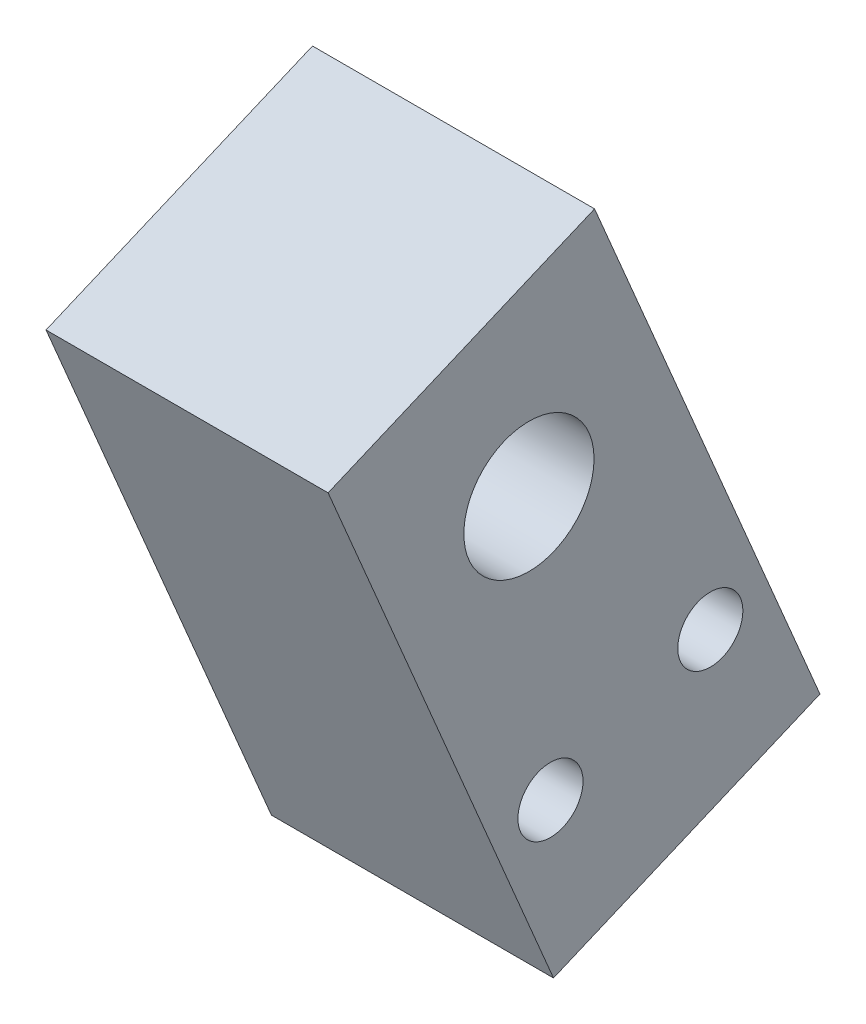
from build123d import *

# Parameters (mm, degrees)
SKETCH2_W                     = 19.5
SKETCH2_H                     = 40
BOSS_EXTRUDE1_DEPTH           = 20
SKETCH3_R                     = 4.5
M10_THREADED_9MM_THRU_DEPTH   = 47.921441178
SKETCH4_R                     = 2.25
M4_CLEARANCE_4_5MM_THRU_DEPTH = 47.921441178


with BuildPart() as part:
    # Sketch2 → Boss-Extrude1 (new body)
    with BuildSketch(Plane(origin=(0, 0.540345249, -1.277454147), x_dir=(-1, 0, 0), z_dir=(0, 0.38956898099658926, -0.9209972904657641))):
        with Locations((11.62712158, -13.175979584)):
            Rectangle(SKETCH2_W, SKETCH2_H)
    extrude(amount=-BOSS_EXTRUDE1_DEPTH)

    # Sketch3 → M10 threaded - 9mm-thru (cut, through all)
    with BuildSketch(Plane(origin=(-1.87712158, 0, 0), x_dir=(0, 0, -1), z_dir=(1, 0, 0))):
        with Locations((-5.916117666, -8.122407734)):
            Circle(SKETCH3_R)
    extrude(amount=-M10_THREADED_9MM_THRU_DEPTH, mode=Mode.SUBTRACT)

    # Sketch4 → M4 clearance - 4.5mm - thru (cut, through all)
    with BuildSketch(Plane(origin=(-1.87712158, 0, 0), x_dir=(0, 0, -1), z_dir=(1, 0, 0))):
        with Locations((6.622107735, -22.362945076)):
            Circle(SKETCH4_R)
        with Locations((-4.42985975, -27.037772848)):
            Circle(SKETCH4_R)
    extrude(amount=-M4_CLEARANCE_4_5MM_THRU_DEPTH, mode=Mode.SUBTRACT)


solid = part.part
